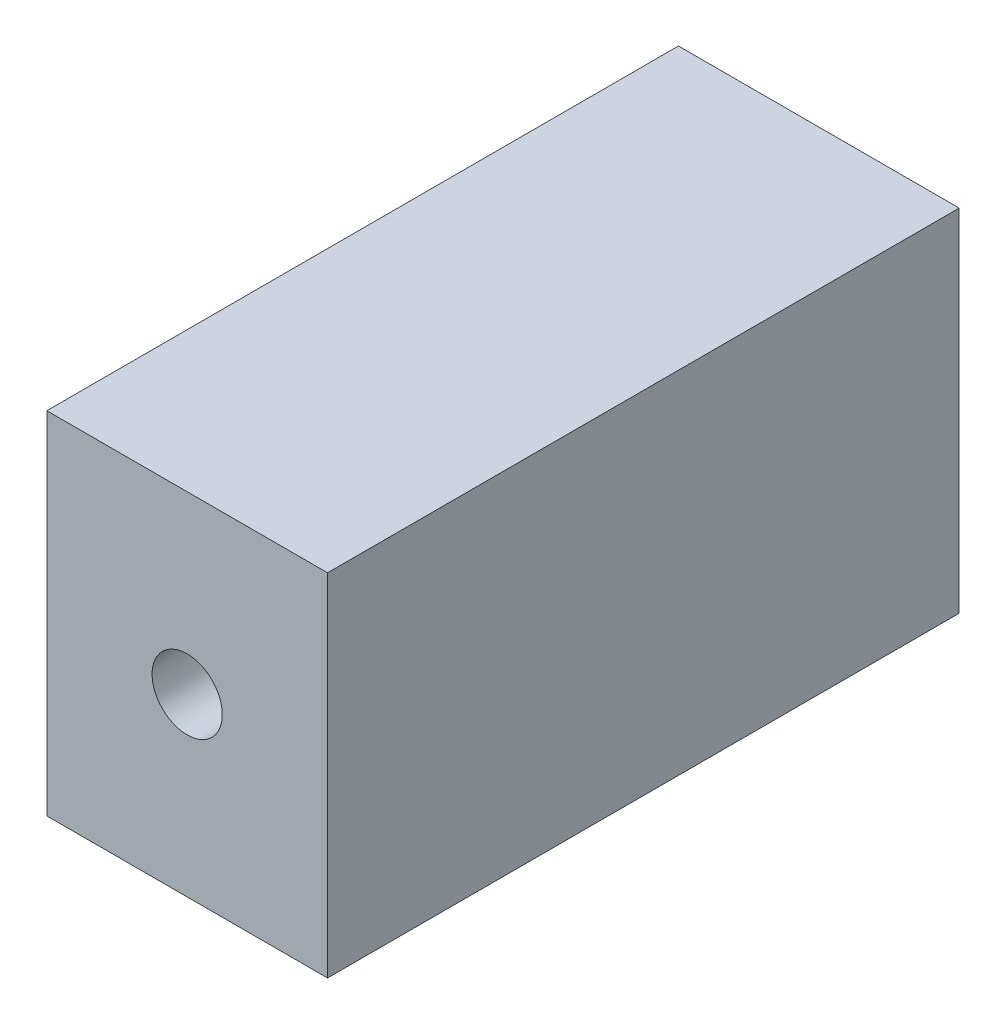
from build123d import *

# Parameters (mm, degrees)
SKETCH1_W           = 20.32
SKETCH1_H           = 45.72
BOSS_EXTRUDE1_DEPTH = 25.4
SKETCH2_R           = 2.54
CUT_EXTRUDE1_DEPTH  = 57.110433967
SKETCH3_R           = 2.54
CUT_EXTRUDE2_DEPTH  = 7.62


with BuildPart() as part:
    # Sketch1 → Boss-Extrude1 (new body)
    with BuildSketch(Plane(origin=(0, 0, 0), x_dir=(1, 0, 0), z_dir=(0, 1, 0))):
        with Locations((10.16, -22.86)):
            Rectangle(SKETCH1_W, SKETCH1_H)
    extrude(amount=BOSS_EXTRUDE1_DEPTH)

    # Sketch2 → Cut-Extrude1 (cut, through all)
    with BuildSketch(Plane.XY.offset(45.72)):
        with Locations((10.16, 12.7)):
            Circle(SKETCH2_R)
    extrude(amount=-CUT_EXTRUDE1_DEPTH, mode=Mode.SUBTRACT)

    # Sketch3 → Cut-Extrude2 (cut)
    with BuildSketch(Plane(origin=(0, 0, 0), x_dir=(-1, 0, 0), z_dir=(0, -1, 0))):
        with Locations(Location((-10.16, -35.56, 0), (0, 0, 90))):
            Circle(SKETCH3_R)
        with Locations(Location((-10.16, -10.16, 0), (0, 0, 90))):
            Circle(SKETCH3_R)
    extrude(amount=-CUT_EXTRUDE2_DEPTH, mode=Mode.SUBTRACT)


solid = part.part
